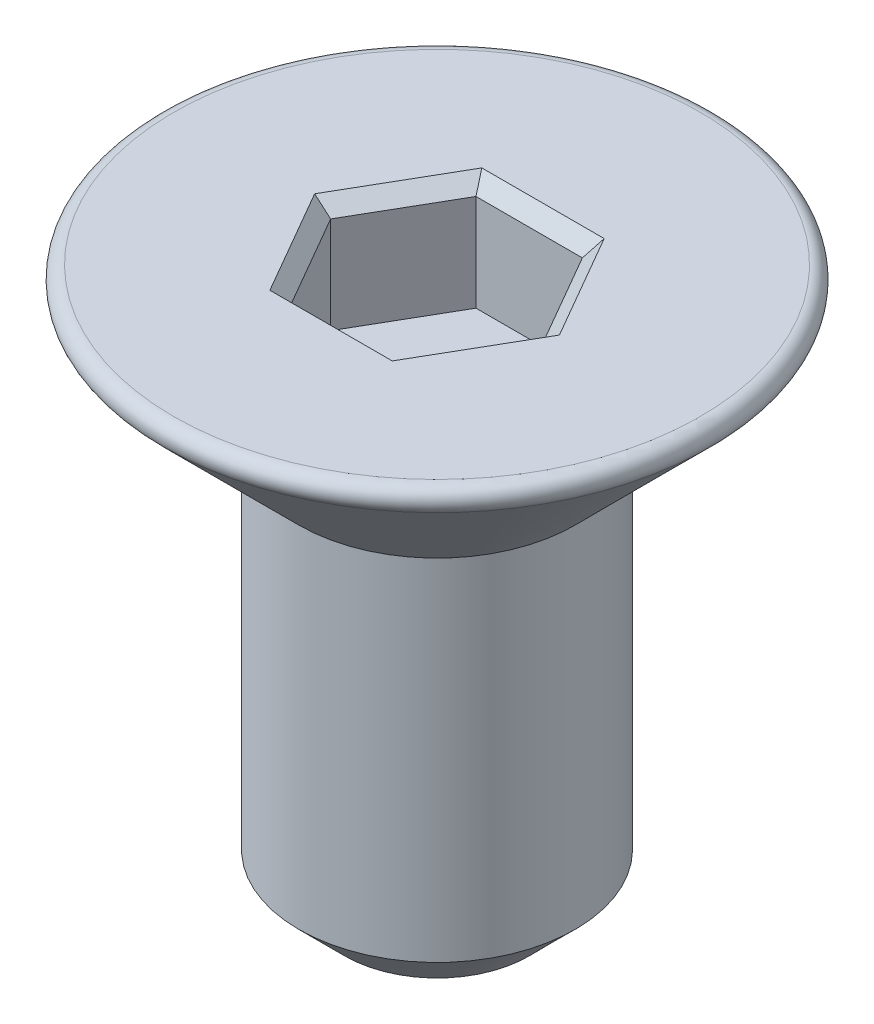
from build123d import *

# Parameters (mm, degrees)
ENL_V_MAT_EXTRU_1_DEPTH = 1.2
CHANFREIN1_SIZE         = 0.15


with BuildPart() as part:
    # Esquisse1 → Révolution1 (revolve)
    with BuildSketch(Plane.XY, mode=Mode.PRIVATE) as r_volution1_sk:
        with BuildLine():
            Line((1.5, -5.5), (1, -6))
            Line((1, -6), (0, -6))
            Line((0, -6), (0, 0))
            Line((0, 0), (2.858578644, 0))
            ThreePointArc((2.858578644, 0), (2.98923494, -0.087301746), (2.958578644, -0.241421356))
            Line((2.958578644, -0.241421356), (1.5, -1.7))
            Line((1.5, -1.7), (1.5, -5.5))
        make_face()
    revolve(r_volution1_sk.sketch.rotate(Axis((0, 6.972972973, 0), (0, -1, 0)), 90), axis=Axis((0, 6.972972973, 0), (0, -1, 0)))

    # Esquisse2 → Enlèv. mat.-Extru.1 (cut)
    with BuildSketch(Plane(origin=(0, 0, 0), x_dir=(1, 0, 0), z_dir=(0, 1, 0))):
        Polygon((-1.154700538, 0), (-0.577350269, -1), (0.577350269, -1), (1.154700538, 0), (0.577350269, 1), (-0.577350269, 1), align=None)
    extrude(amount=-ENL_V_MAT_EXTRU_1_DEPTH, mode=Mode.SUBTRACT)

    # Chanfrein1
    chanfrein1_edges = [part.edges().sort_by_distance(p)[0] for p in [
        (-0.8660254037844384, 0, -0.49999999999999983),
        (-0.8660254037844384, 0, 0.5),
        (0, 0, 1),
        (0.866025403784439, 0, 0.5),
        (0.866025403784439, 0, -0.5000000000000004),
        (0, 0, -1),
    ]]
    chamfer(chanfrein1_edges, length=CHANFREIN1_SIZE)


solid = part.part
